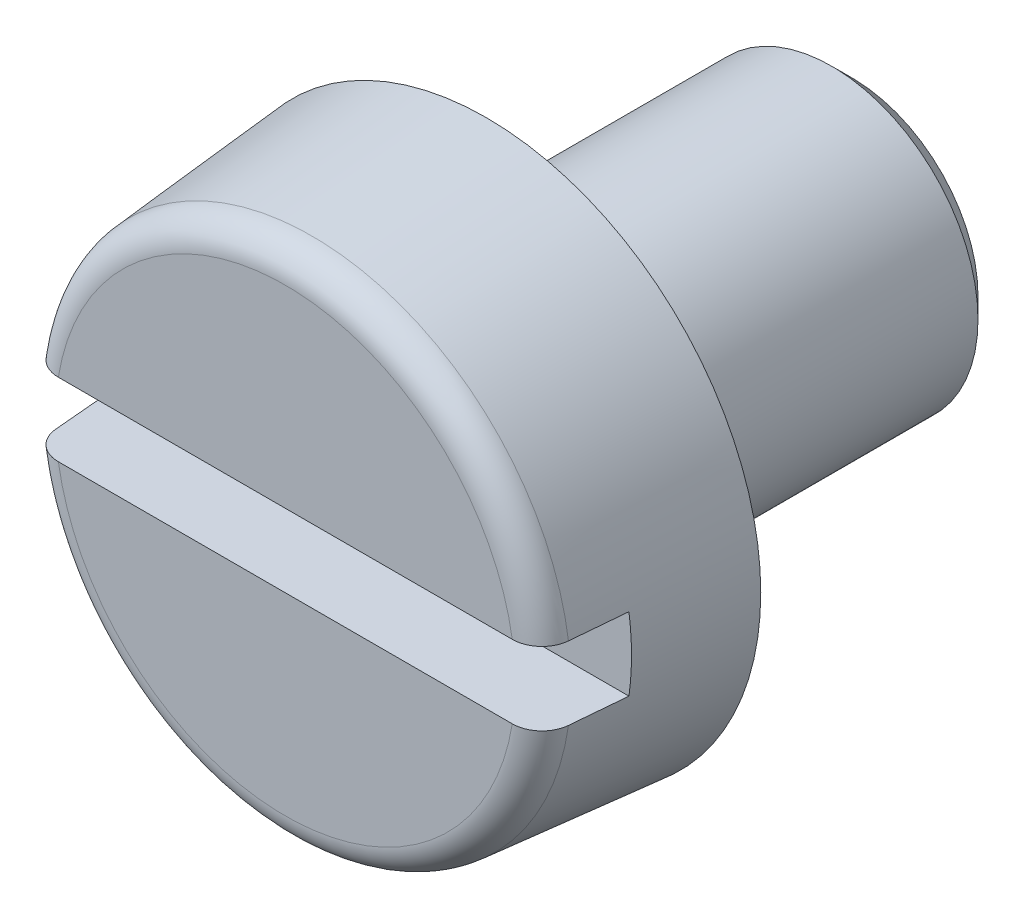
from build123d import *

# Parameters (mm, degrees)
SKICA1_R                 = 1.5
VYSUNOUT1_DEPTH          = 1.1
VYSUNOUT1_TAPER          = 5
SKICA2_W                 = 3
SKICA2_H                 = 0.4
ODEBRAT_VYSUNUT_M1_DEPTH = 0.45
SKICA3_R                 = 0.8
VYSUNOUT2_DEPTH          = 2
ZAOBLIT1_R               = 0.1
ZKOSIT1_SIZE             = 0.112
ZAOBLIT2_R               = 0.16


with BuildPart() as part:
    # Skica1 → Vysunout1 (new body)
    with BuildSketch(Plane.XY):
        Circle(SKICA1_R)
    extrude(amount=VYSUNOUT1_DEPTH, taper=VYSUNOUT1_TAPER)

    # Skica2 → Odebrat vysunutím1 (cut)
    with BuildSketch(Plane.XY.offset(1.1)):
        Rectangle(SKICA2_W, SKICA2_H)
    extrude(amount=-ODEBRAT_VYSUNUT_M1_DEPTH, mode=Mode.SUBTRACT)

    # Skica3 → Vysunout2 (add)
    with BuildSketch(Plane(origin=(0, 0, 0), x_dir=(-1, 0, 0), z_dir=(0, 0, -1))):
        with Locations(Location((0, 0, 0), (0, 0, 180))):
            Circle(SKICA3_R)
    extrude(amount=VYSUNOUT2_DEPTH)

    # Zaoblit1
    zaoblit1_edges = [part.edges().sort_by_distance(p)[0] for p in [
        (-0.8, 0, 0),
    ]]
    fillet(zaoblit1_edges, radius=ZAOBLIT1_R)

    # Zkosit1
    zkosit1_edges = [part.edges().sort_by_distance(p)[0] for p in [
        (-0.8, 0, -2),
    ]]
    chamfer(zkosit1_edges, length=ZKOSIT1_SIZE)

    # Zaoblit2
    zaoblit2_edges = [part.edges().sort_by_distance(p)[0] for p in [
        (0, 1.40376247, 1.1),
        (0, -1.40376247, 1.1),
    ]]
    fillet(zaoblit2_edges, radius=ZAOBLIT2_R)


solid = part.part
